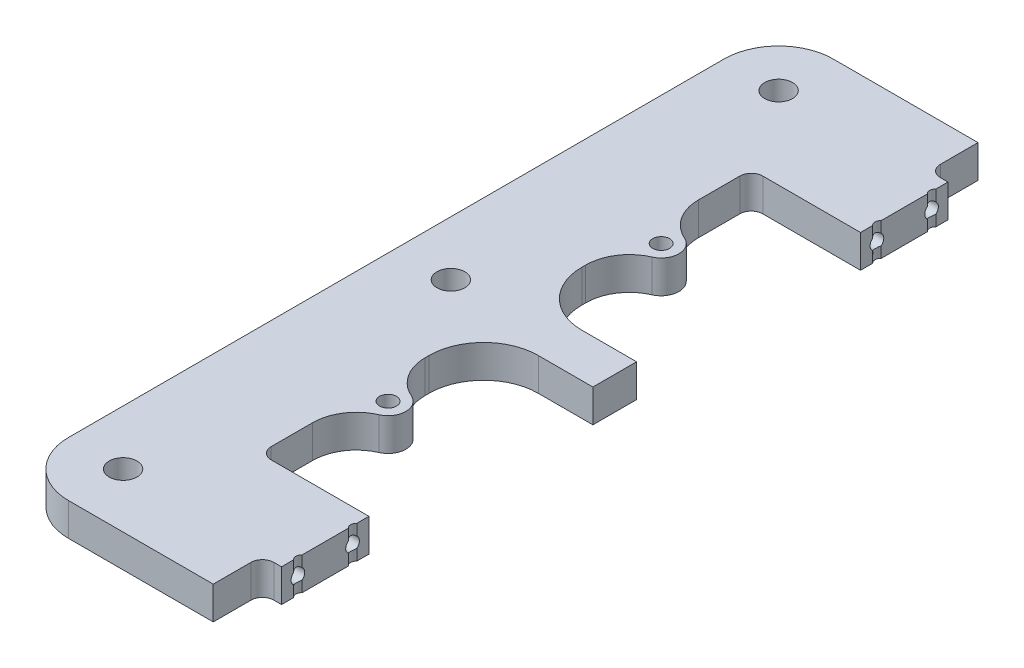
from build123d import *

# Parameters (mm, degrees)
EXTRUDE_1_DEPTH     = 6
SKETCH_2_R          = 1.25
CUT_EXTRUDE_1_DEPTH = 10
SKETCH_3_R          = 1.05
CUT_EXTRUDE_2_DEPTH = 81.845531726
SKETCH_4_R          = 2.55
CUT_EXTRUDE_3_DEPTH = 81.845531783
FILLET_1_R          = 2.1
SKETCH_5_W          = 8
SKETCH_5_H          = 6
EXTRUDE_2_DEPTH     = 20
FILLET_2_R          = 10
FILLET_3_R          = 10
SKETCH_7_R          = 1.55
EXTRUDE_3_DEPTH     = 6
FILLET_4_R          = 8


with BuildPart() as part:
    # ｽｹｯﾁ1 → ﾎﾞｽ - 押し出し1 (new body)
    with BuildSketch(Plane(origin=(0, 0, 0), x_dir=(1, 0, 0), z_dir=(0, 1, 0))):
        Polygon((0, -70), (0, 70), (36.5, 70), (36.5, 61), (40, 61), (40, 45), (20, 45), (20, -45), (40, -45), (40, -61), (36.5, -61), (36.5, -70), align=None)
    extrude(amount=EXTRUDE_1_DEPTH)

    # ｽｹｯﾁ2 → ｶｯﾄ - 押し出し1 (cut)
    with BuildSketch(Plane(origin=(40, 0, 0), x_dir=(0, 0, -1), z_dir=(1, 0, 0))):
        with Locations((48, 3)):
            Circle(SKETCH_2_R)
        with Locations((58, 3)):
            Circle(SKETCH_2_R)
        with Locations(Location((-48, 3, 0), (0, 0, 180))):
            Circle(SKETCH_2_R)
        with Locations(Location((-58, 3, 0), (0, 0, 180))):
            Circle(SKETCH_2_R)
    extrude(amount=-CUT_EXTRUDE_1_DEPTH, mode=Mode.SUBTRACT)

    # ｽｹｯﾁ3 → ｶｯﾄ - 押し出し2 (cut, through all)
    with BuildSketch(Plane(origin=(0, 6, 0), x_dir=(1, 0, 0), z_dir=(0, 1, 0))):
        with Locations((40.7, 58)):
            Circle(SKETCH_3_R)
        with Locations((40.7, 48)):
            Circle(SKETCH_3_R)
        with Locations((40.7, -48)):
            Circle(SKETCH_3_R)
        with Locations((40.7, -58)):
            Circle(SKETCH_3_R)
    extrude(amount=-CUT_EXTRUDE_2_DEPTH, mode=Mode.SUBTRACT)

    # ｽｹｯﾁ4 → ｶｯﾄ - 押し出し3 (cut, through all)
    with BuildSketch(Plane(origin=(0, 6, 0), x_dir=(1, 0, 0), z_dir=(0, 1, 0))):
        with Locations(Location((10, 0, 0), (0, 0, 270))):
            Circle(SKETCH_4_R)
        with Locations(Location((10, 60, 0), (0, 0, 270))):
            Circle(SKETCH_4_R)
        with Locations(Location((10, -60, 0), (0, 0, 270))):
            Circle(SKETCH_4_R)
    extrude(amount=-CUT_EXTRUDE_3_DEPTH, mode=Mode.SUBTRACT)

    # ﾌｨﾚｯﾄ1
    fillet_1_edges = [part.edges().sort_by_distance(p)[0] for p in [
        (36.5, 3, -61),
        (20, 3, -45),
        (20, 3, 45),
        (36.5, 3, 61),
    ]]
    fillet(fillet_1_edges, radius=FILLET_1_R)

    # ｽｹｯﾁ5 → ﾎﾞｽ - 押し出し2 (add)
    with BuildSketch(Plane(origin=(20, 0, 0), x_dir=(0, 0, -1), z_dir=(1, 0, 0))):
        with Locations((0, 3)):
            Rectangle(SKETCH_5_W, SKETCH_5_H)
    extrude(amount=EXTRUDE_2_DEPTH)

    # ﾌｨﾚｯﾄ2
    fillet_2_edges = [part.edges().sort_by_distance(p)[0] for p in [
        (20, 3, 4),
        (20, 3, -4),
    ]]
    fillet(fillet_2_edges, radius=FILLET_2_R)

    # ﾌｨﾚｯﾄ3
    fillet_3_edges = [part.edges().sort_by_distance(p)[0] for p in [
        (0, 3, 70),
        (0, 3, -70),
    ]]
    fillet(fillet_3_edges, radius=FILLET_3_R)

    # ｽｹｯﾁ7 → ﾎﾞｽ - 押し出し3 (add, through all)
    # profile 1 of 2: a face of its own
    with BuildSketch(Plane(origin=(0, 6, 0), x_dir=(1, 0, 0), z_dir=(0, 1, 0))):
        with BuildLine():
            Line((23.5, 28.25), (20, 28.25))
            Line((20, 28.25), (20, 21.75))
            Line((20, 21.75), (23.5, 21.75))
            ThreePointArc((23.5, 21.75), (26.75, 25), (23.5, 28.25))
        make_face()
        with Locations(Location((23.5, 25, 0), (0, 0, 270))):
            Circle(SKETCH_7_R, mode=Mode.SUBTRACT)
    # profile 2 of 2: a face of its own
    with BuildSketch(Plane(origin=(0, 6, 0), x_dir=(1, 0, 0), z_dir=(0, 1, 0))):
        with BuildLine():
            Line((20, -21.75), (23.5, -21.75))
            ThreePointArc((23.5, -21.75), (26.75, -25), (23.5, -28.25))
            Line((23.5, -28.25), (20, -28.25))
            Line((20, -28.25), (20, -21.75))
        make_face()
        with Locations(Location((23.5, -25, 0), (0, 0, 90))):
            Circle(SKETCH_7_R, mode=Mode.SUBTRACT)
    extrude(amount=-EXTRUDE_3_DEPTH)

    # ﾌｨﾚｯﾄ4
    fillet_4_edges = [part.edges().sort_by_distance(p)[0] for p in [
        (20, 3, 28.25),
        (20, 3, 21.75),
        (20, 3, -28.25),
        (20, 3, -21.75),
    ]]
    fillet(fillet_4_edges, radius=FILLET_4_R)


solid = part.part
